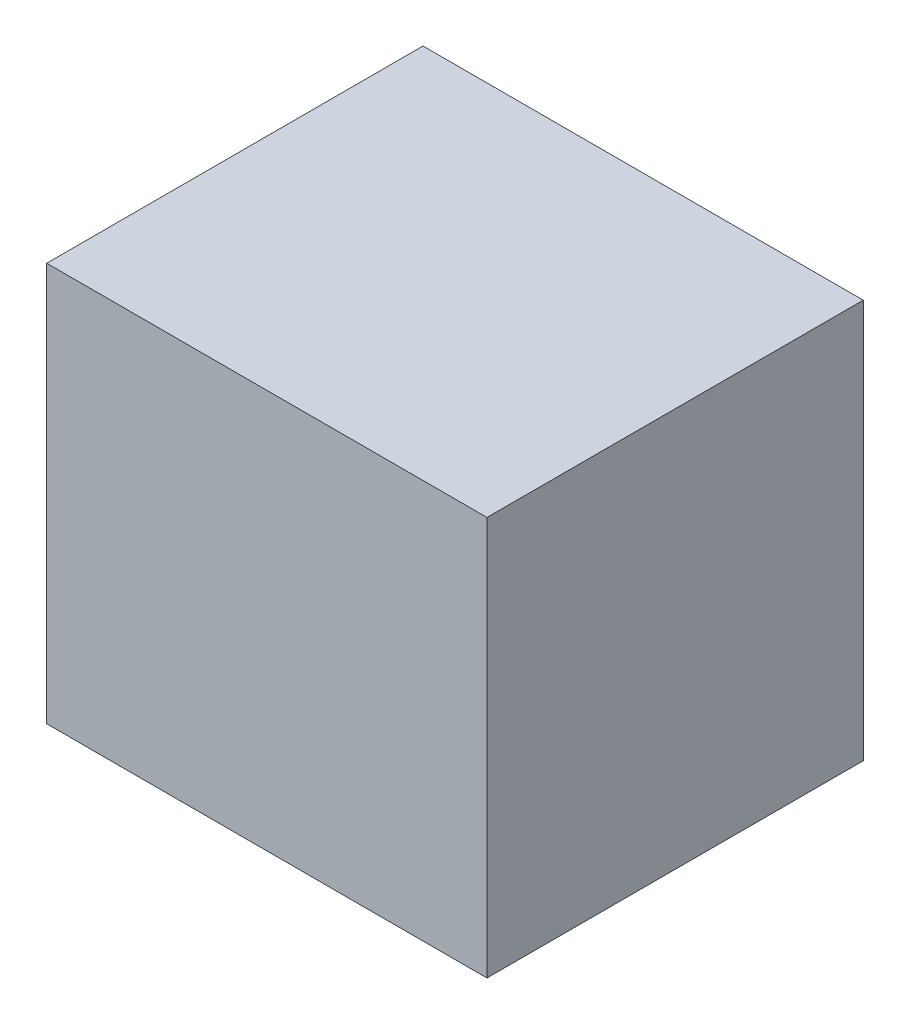
from build123d import *

# Parameters (mm, degrees)
SKETCH1_W               = 2.9718
SKETCH1_H               = 2.6924
COMPONENT_OUTLINE_DEPTH = 2.54


with BuildPart() as part:
    # Sketch1 → Component_Outline (new body)
    with BuildSketch(Plane.XY):
        with Locations((-0.042418, 0.1016)):
            Rectangle(SKETCH1_W, SKETCH1_H)
    extrude(amount=COMPONENT_OUTLINE_DEPTH)


solid = part.part
